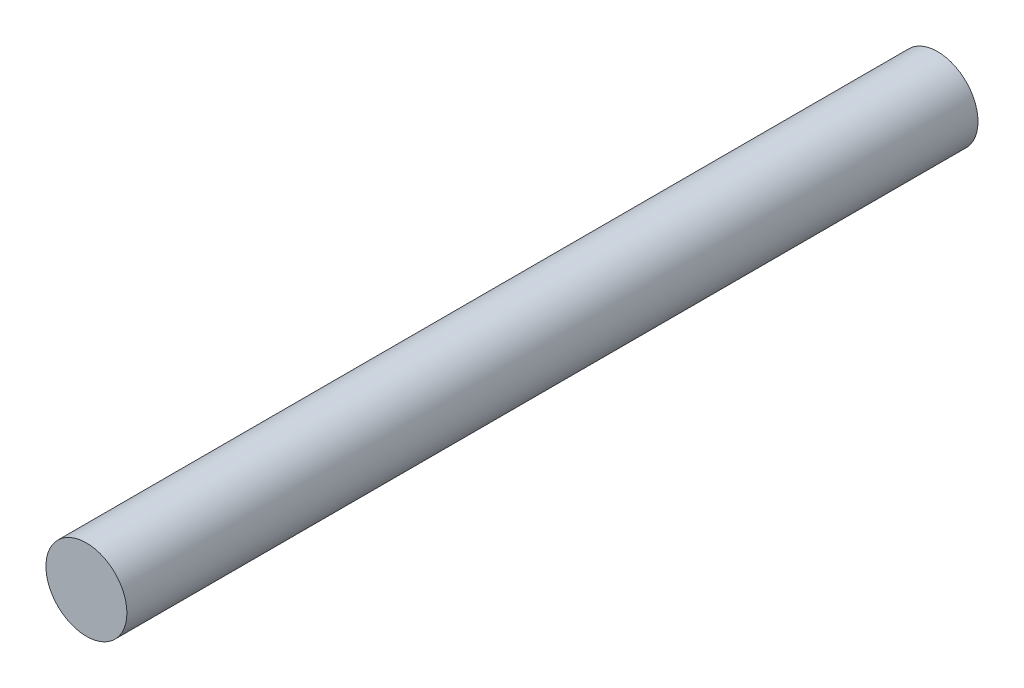
from build123d import *

# Parameters (mm, degrees)
SCHIZZO1_R                   = 4
ESTRUSIONE_ESTRUSIONE1_DEPTH = 84.09


with BuildPart() as part:
    # Schizzo1 → Estrusione-Estrusione1 (new body)
    with BuildSketch(Plane.XY):
        Circle(SCHIZZO1_R)
    extrude(amount=ESTRUSIONE_ESTRUSIONE1_DEPTH)


solid = part.part
